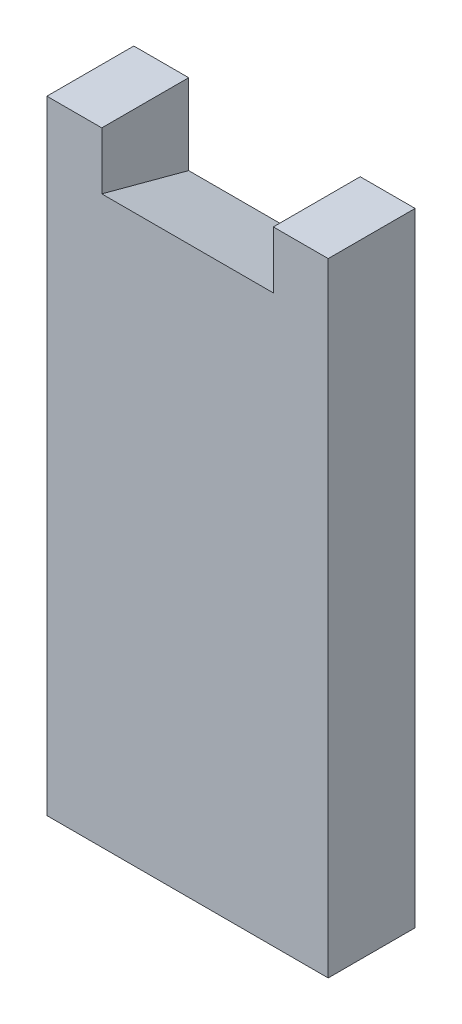
from build123d import *

# Parameters (mm, degrees)
EXTRUDE_1_DEPTH = 7.6
DRAFT_5_ANGLE   = -15


with BuildPart() as part:
    # 草图1 → 凸台-拉伸1 (new body)
    with BuildSketch(Plane.XY):
        Polygon((4.8, 0), (0, 0), (0, -54.485), (24.6, -54.485), (24.6, 0), (19.8, 0), (19.8, -5), (4.8, -5), align=None)
    extrude(amount=EXTRUDE_1_DEPTH)

    # 拔模5
    draft_5_faces = [part.faces().sort_by_distance(p)[0] for p in [
        (12.3, -5, 3.8),
    ]]
    draft(draft_5_faces, Plane.XY.offset(7.6), DRAFT_5_ANGLE)


solid = part.part
